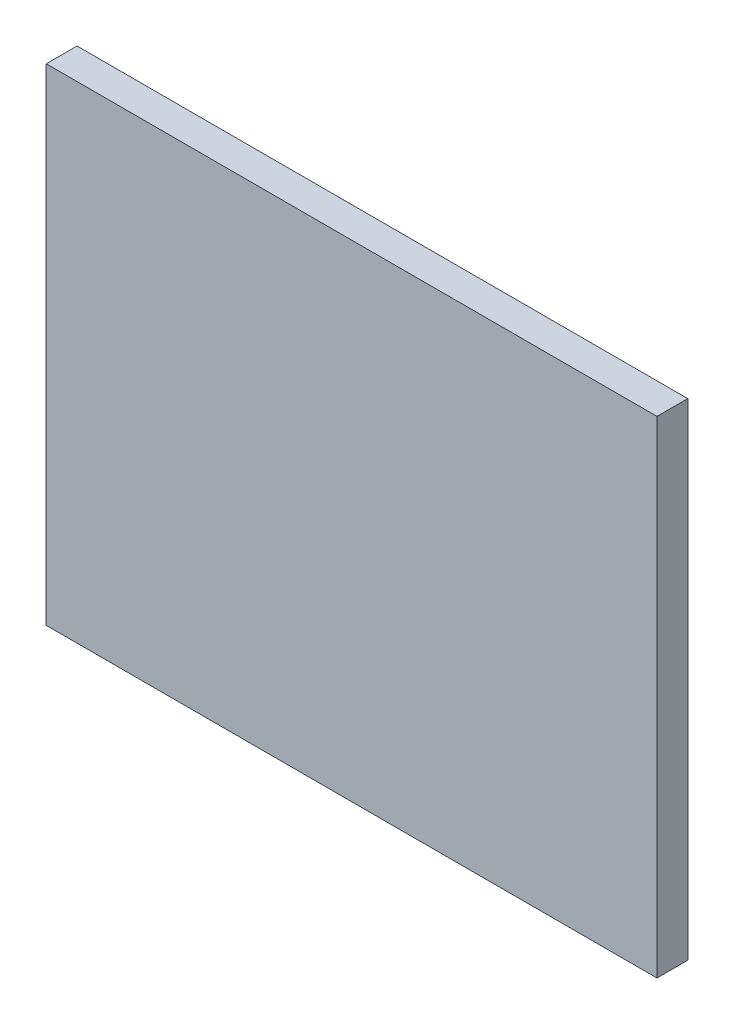
from build123d import *

# Parameters (mm, degrees)
SKETCH_1_W          = 120
SKETCH_1_H          = 79
EXTRUDE_1_DEPTH     = 5
SKETCH_2_W          = 20.802208865
SKETCH_2_H          = 79
CUT_EXTRUDE_1_DEPTH = 8


with BuildPart() as part:
    # 草图1 → 凸台-拉伸1 (new body)
    with BuildSketch(Plane.XY):
        Rectangle(SKETCH_1_W, SKETCH_1_H)
    extrude(amount=EXTRUDE_1_DEPTH)

    # 草图2 → 切除-拉伸1 (cut)
    with BuildSketch(Plane(origin=(0, 0, 0), x_dir=(-1, 0, 0), z_dir=(0, 0, -1))):
        with Locations((-49.598895568, 0)):
            Rectangle(SKETCH_2_W, SKETCH_2_H)
    extrude(amount=-CUT_EXTRUDE_1_DEPTH, mode=Mode.SUBTRACT)


solid = part.part
